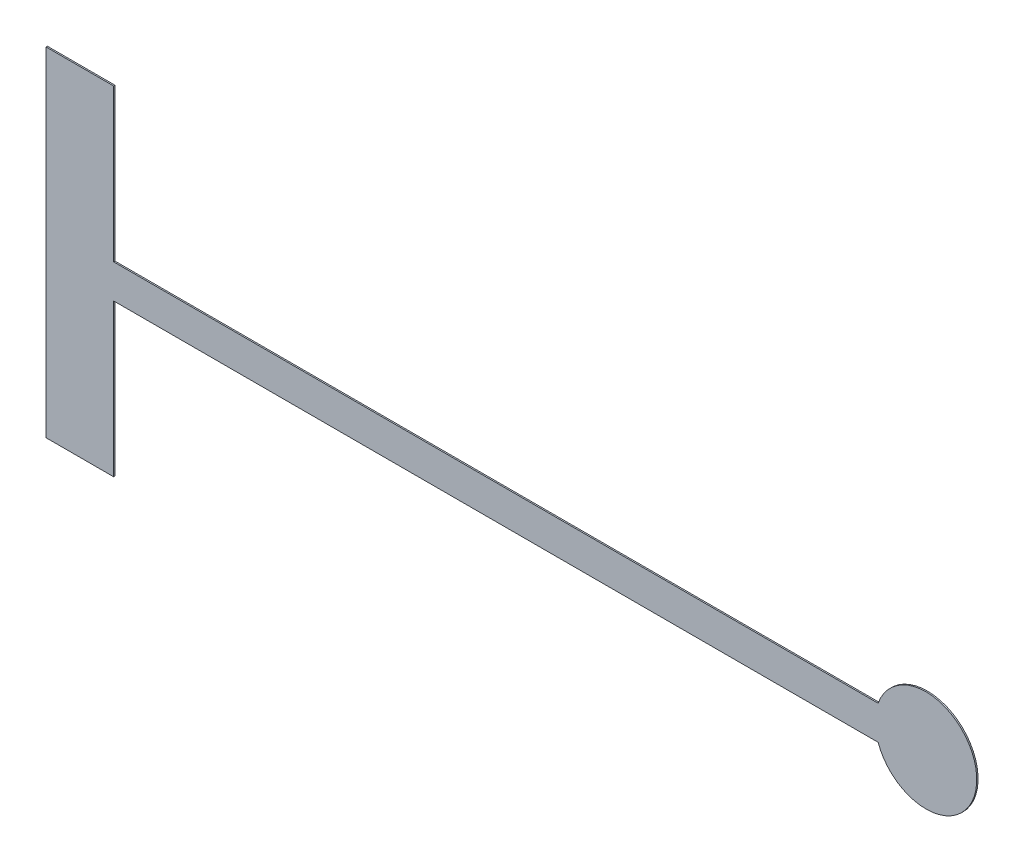
from build123d import *

# Parameters (mm, degrees)
BOSS_EXTRUDE1_DEPTH = 20
SKETCH2_W           = 1000
SKETCH2_H           = 2250
CUT_EXTRUDE1_DEPTH  = 12993.801853334
CUT_EXTRUDE4_DEPTH  = 12993.801853334
SKETCH5_W           = 11500
SKETCH5_H           = 500
BOSS_EXTRUDE2_DEPTH = 20


with BuildPart() as part:
    # Sketch1 → Boss-Extrude1 (new body)
    with BuildSketch(Plane.XY):
        with BuildLine():
            Line((1000, 250), (5000, 250))
            Line((5000, 250), (5000, 125))
            Line((5000, 125), (9000, 125))
            Line((9000, 125), (9000, 100))
            Line((9000, 100), (11256.696562634, 100))
            ThreePointArc((11256.696562634, 100), (12750, 0), (11256.696562634, -100))
            Line((11256.696562634, -100), (9000, -100))
            Line((9000, -100), (9000, -125))
            Line((9000, -125), (5000, -125))
            Line((5000, -125), (5000, -250))
            Line((5000, -250), (1000, -250))
            Line((1000, -250), (1000, -2500))
            Line((1000, -2500), (-1000, -2500))
            Line((-1000, -2500), (-1000, 2500))
            Line((-1000, 2500), (1000, 2500))
            Line((1000, 2500), (1000, 250))
        make_face()
    extrude(amount=-BOSS_EXTRUDE1_DEPTH)

    # Sketch2 → Cut-Extrude1 (cut, through all)
    with BuildSketch(Plane.XY):
        with Locations((500, 1375)):
            Rectangle(SKETCH2_W, SKETCH2_H)
        with Locations((500, -1375)):
            Rectangle(SKETCH2_W, SKETCH2_H)
    extrude(amount=-CUT_EXTRUDE1_DEPTH, mode=Mode.SUBTRACT)

    # Sketch3 → Cut-Extrude4 (cut, through all)
    with BuildSketch(Plane.XY):
        Polygon((1500, -250), (3250, -250), (5000, -250), (5000, -150), (3250, -150), (3250, -200), (1500, -200), align=None)
    cut_extrude4 = extrude(amount=-CUT_EXTRUDE4_DEPTH, mode=Mode.SUBTRACT)

    # Mirror1: Cut-Extrude4 across plane
    add(cut_extrude4.mirror(Plane.ZX), mode=Mode.SUBTRACT)

    # Sketch5 → Boss-Extrude2 (add)
    with BuildSketch(Plane.XY):
        with Locations((5750, 0)):
            Rectangle(SKETCH5_W, SKETCH5_H)
    extrude(amount=-BOSS_EXTRUDE2_DEPTH)


solid = part.part
